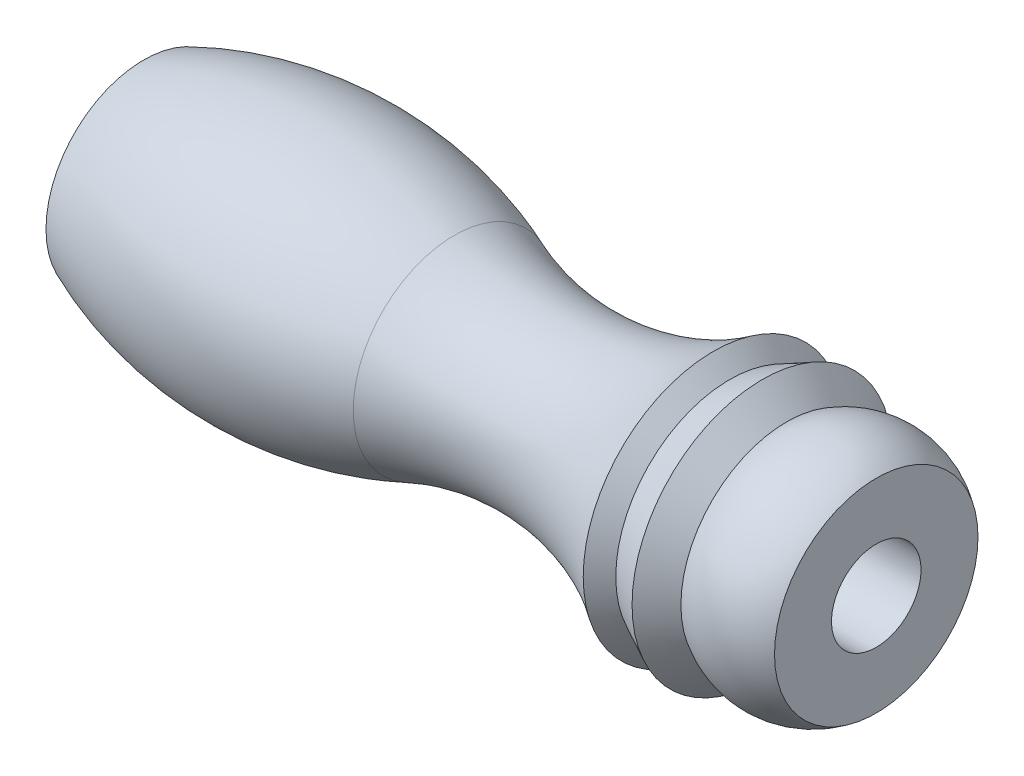
from build123d import *

# Parameters (mm, degrees)
SKETCH_2_R          = 5.5
CUT_EXTRUDE_1_DEPTH = 93.800862196


with BuildPart() as part:
    # 草图1 → 旋转1 (revolve)
    with BuildSketch(Plane.XY, mode=Mode.PRIVATE) as revolve_1_sk:
        with BuildLine():
            Line((0, 0), (0, 12))
            ThreePointArc((0, 12), (19.041155999, 15.996922297), (38.166312057, 12.423490416))
            ThreePointArc((38.166312057, 12.423490416), (54.532546306, 10.211825865), (70, 16))
            Line((70, 16), (72, 14))
            Line((72, 14), (76, 16))
            Line((76, 16), (79, 13))
            ThreePointArc((79, 13), (84.575017818, 14.400392001), (90, 12.5))
            Line((90, 12.5), (90, 0))
            Line((90, 0), (0, 0))
        make_face()
    revolve(revolve_1_sk.sketch.rotate(Axis((0, 0, 0), (1, 0, 0)), 90), axis=Axis((0, 0, 0), (1, 0, 0)))

    # 草图2 → 切除-拉伸1 (cut, through all)
    with BuildSketch(Plane(origin=(90, 0, 0), x_dir=(0, 0, -1), z_dir=(1, 0, 0))):
        Circle(SKETCH_2_R)
    extrude(amount=-CUT_EXTRUDE_1_DEPTH, mode=Mode.SUBTRACT)


solid = part.part
